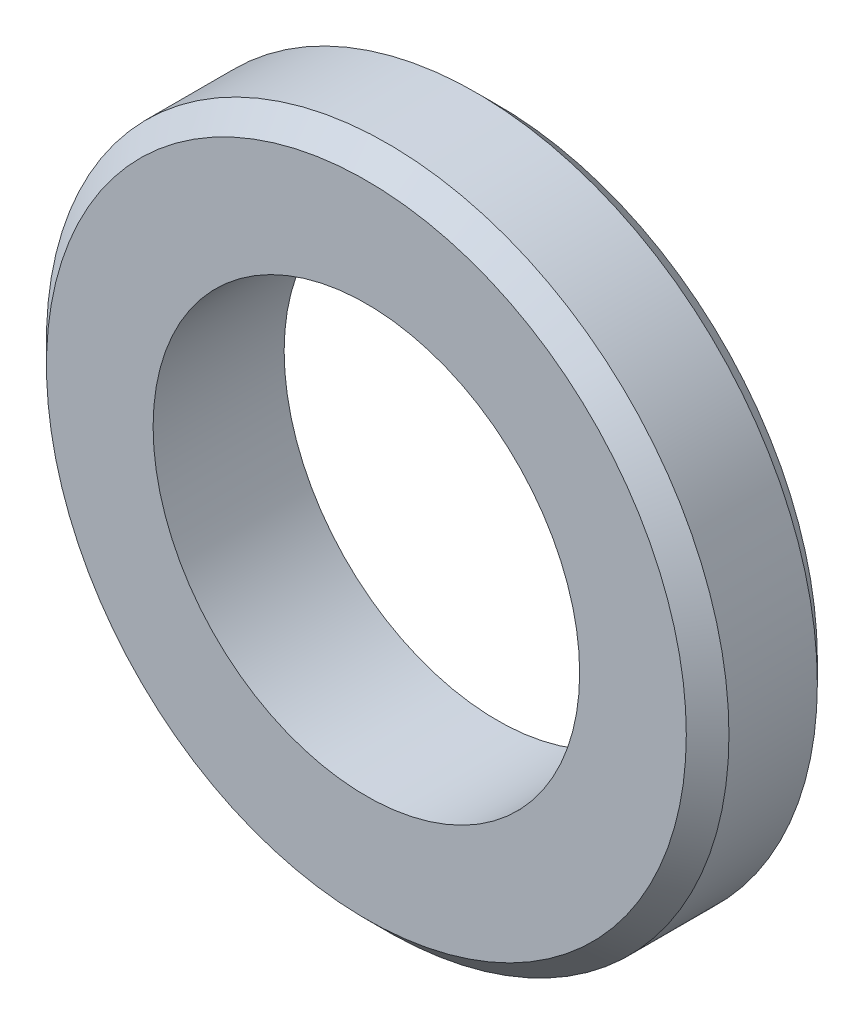
from build123d import *

# Parameters (mm, degrees)
SKETCH1_R           = 12.7
SKETCH1_R_2         = 7.9375
BOSS_EXTRUDE1_DEPTH = 4.8768
CHAMFER1_SIZE       = 0.79375


with BuildPart() as part:
    # Sketch1 → Boss-Extrude1 (new body)
    with BuildSketch(Plane.XY):
        Circle(SKETCH1_R)
        Circle(SKETCH1_R_2, mode=Mode.SUBTRACT)
    extrude(amount=BOSS_EXTRUDE1_DEPTH)

    # Chamfer1
    chamfer1_edges = [part.edges().sort_by_distance(p)[0] for p in [
        (-12.7, 0, 0),
        (-12.7, 0, 4.8768),
    ]]
    chamfer(chamfer1_edges, length=CHAMFER1_SIZE)


solid = part.part
